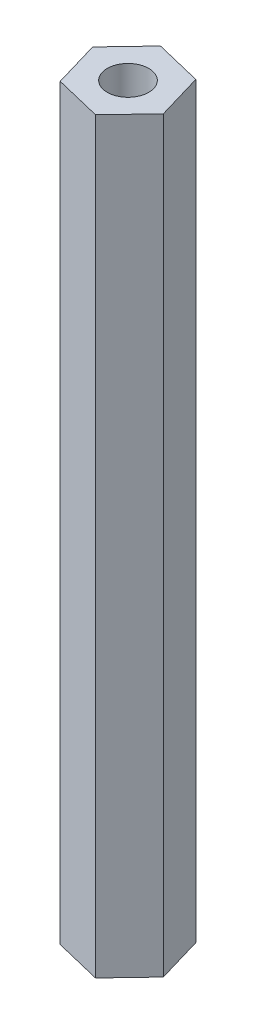
from build123d import *

# Parameters (mm, degrees)
SKETCH1_R           = 1.5
BOSS_EXTRUDE1_DEPTH = 27


with BuildPart() as part:
    # Sketch1 → Boss-Extrude1 (new, symmetric)
    with BuildSketch(Plane(origin=(0, 0, 0), x_dir=(1, 0, 0), z_dir=(0, 1, 0))):
        Polygon((0.977287067, -3.32338833), (3.366782253, -0.815338738), (2.389495187, 2.508049591), (-0.977287067, 3.32338833), (-3.366782253, 0.815338738), (-2.389495187, -2.508049591), align=None)
        with Locations(Location((0, 0, 0), (0, 0, 270))):
            Circle(SKETCH1_R, mode=Mode.SUBTRACT)
    extrude(amount=BOSS_EXTRUDE1_DEPTH, both=True)


solid = part.part
